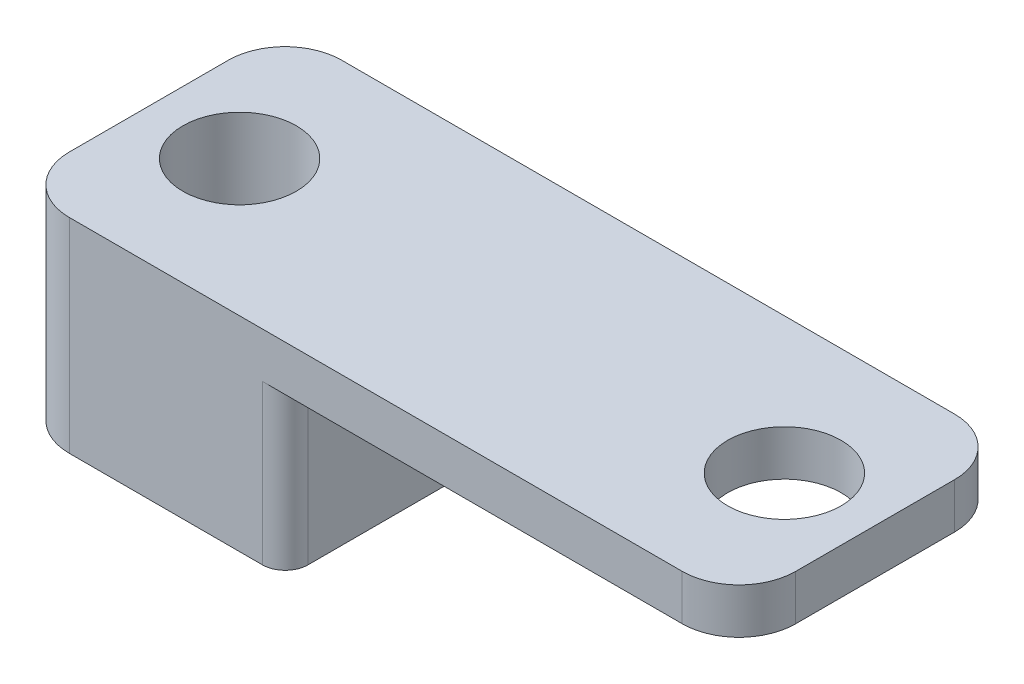
from build123d import *

# Parameters (mm, degrees)
SKETCH_1_R          = 2.5
EXTRUDE_1_DEPTH     = 20
SKETCH_2_W          = 28.6658273
SKETCH_2_H          = 20.338801826
CUT_EXTRUDE_1_DEPTH = 18
SKETCH_3_W          = 21.28696294
SKETCH_3_H          = 15.18623143
CUT_EXTRUDE_2_DEPTH = 11
FILLET_1_R          = 1


with BuildPart() as part:
    # Эскиз1 → Бобышка-Вытянуть1 (new body)
    with BuildSketch(Plane(origin=(0, 0, 0), x_dir=(1, 0, 0), z_dir=(0, 1, 0))):
        with BuildLine():
            Line((-13.5, 6), (13.5, 6))
            ThreePointArc((13.5, 6), (15.267766953, 5.267766953), (16, 3.5))
            Line((16, 3.5), (16, -3.5))
            ThreePointArc((16, -3.5), (15.267766953, -5.267766953), (13.5, -6))
            Line((13.5, -6), (-13.5, -6))
            ThreePointArc((-13.5, -6), (-15.267766953, -5.267766953), (-16, -3.5))
            Line((-16, -3.5), (-16, 3.5))
            ThreePointArc((-16, 3.5), (-15.267766953, 5.267766953), (-13.5, 6))
        make_face()
        with Locations(Location((-12, 0, 0), (0, 0, 270))):
            Circle(SKETCH_1_R, mode=Mode.SUBTRACT)
        with Locations(Location((12, 0, 0), (0, 0, 270))):
            Circle(SKETCH_1_R, mode=Mode.SUBTRACT)
    extrude(amount=EXTRUDE_1_DEPTH)

    # Эскиз2 → Вырез-Вытянуть1 (cut)
    with BuildSketch(Plane.XZ):
        with Locations((10.342984763, 0)):
            Rectangle(SKETCH_2_W, SKETCH_2_H)
    extrude(amount=-CUT_EXTRUDE_1_DEPTH, mode=Mode.SUBTRACT)

    # Эскиз3 → Вырез-Вытянуть2 (cut)
    with BuildSketch(Plane.XZ):
        with Locations((-5.752302283, -0.036989119)):
            Rectangle(SKETCH_3_W, SKETCH_3_H)
    extrude(amount=-CUT_EXTRUDE_2_DEPTH, mode=Mode.SUBTRACT)

    # Скругление1
    fillet_1_edges = [part.edges().sort_by_distance(p)[0] for p in [
        (-3.989928887, 14.5, -6),
        (-3.989928887, 14.5, 6),
    ]]
    fillet(fillet_1_edges, radius=FILLET_1_R)


solid = part.part
